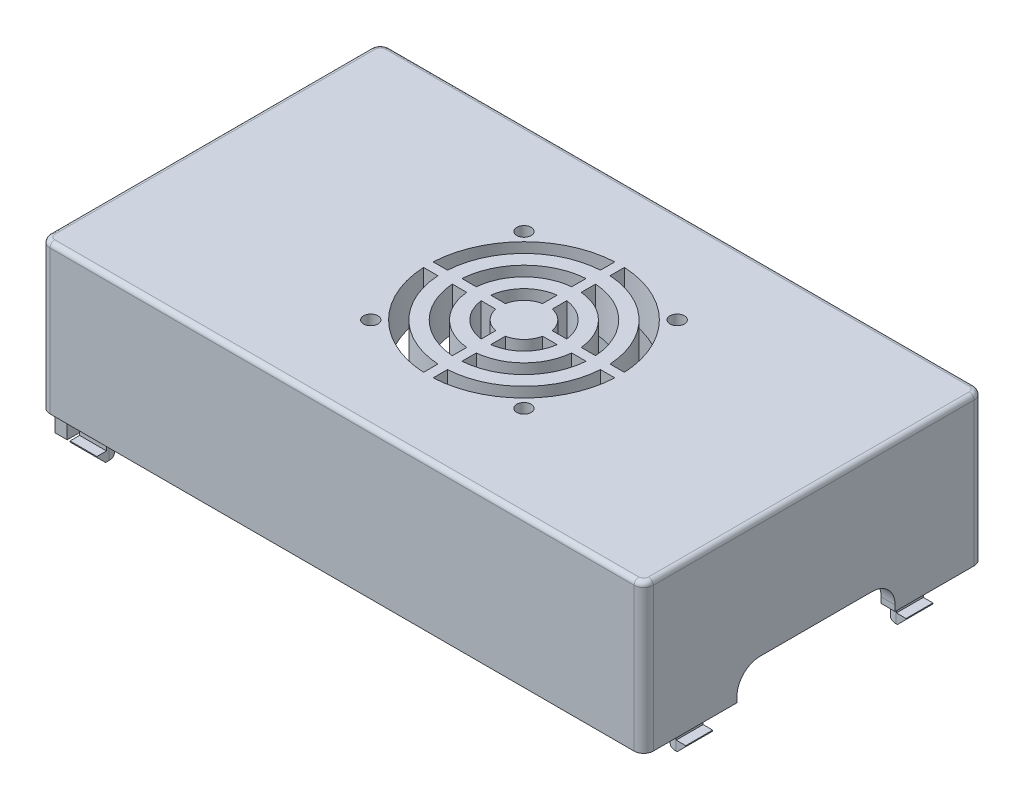
from build123d import *

# Parameters (mm, degrees)
SKETCH1_W           = 126
SKETCH1_H           = 71
BOSS_EXTRUDE1_DEPTH = 31
SKETCH2_W           = 120.6
SKETCH2_H           = 66
CUT_EXTRUDE1_DEPTH  = 22
CUT_EXTRUDE2_REACH  = 136.526
SKETCH3_W           = 33
SKETCH3_H           = 6
FILLET1_R           = 4.8
BOSS_EXTRUDE2_DEPTH = 2.5
CUT_EXTRUDE3_DEPTH  = 88.916153237
SKETCH6_R           = 1.5
CUT_EXTRUDE4_DEPTH  = 88.916153237
FILLET2_R           = 2
FILLET3_R           = 1
BOSS_EXTRUDE3_DEPTH = 4.7
BOSS_EXTRUDE4_START = 5.3
BOSS_EXTRUDE4_DEPTH = 5.3
CUT_EXTRUDE5_DEPTH  = 60.5
CUT_EXTRUDE6_REACH  = 100.093
BOSS_EXTRUDE5_DEPTH = 5.62751
BOSS_EXTRUDE6_DEPTH = 5.62751
BOSS_EXTRUDE7_DEPTH = 5.62751


with BuildPart() as part:
    # Sketch1 → Boss-Extrude1 (new body)
    with BuildSketch(Plane(origin=(0, 0, 0), x_dir=(1, 0, 0), z_dir=(0, 1, 0))):
        Rectangle(SKETCH1_W, SKETCH1_H)
    extrude(amount=BOSS_EXTRUDE1_DEPTH)

    # Sketch2 → Cut-Extrude1 (cut)
    with BuildSketch(Plane.XZ):
        with Locations((-0.2, 0)):
            Rectangle(SKETCH2_W, SKETCH2_H)
    extrude(amount=-CUT_EXTRUDE1_DEPTH, mode=Mode.SUBTRACT)

    # Sketch3 → Cut-Extrude2 (cut, up to next)
    with BuildSketch(Plane(origin=(63, 0, 0), x_dir=(0, 0, -1), z_dir=(1, 0, 0)), mode=Mode.PRIVATE) as cut_extrude2_sk1:
        with Locations((0.5, 3)):
            Rectangle(SKETCH3_W, SKETCH3_H)
    cut_extrude2_tool1 = extrude(cut_extrude2_sk1.sketch, amount=-CUT_EXTRUDE2_REACH, mode=Mode.PRIVATE) & part.part
    add(cut_extrude2_tool1.solids().sort_by_distance((63, 3, -0.5))[0], mode=Mode.SUBTRACT)

    # Fillet1
    fillet1_edges = [part.edges().sort_by_distance(p)[0] for p in [
        (61.55, 6, -17),
        (61.55, 6, 16),
    ]]
    fillet(fillet1_edges, radius=FILLET1_R)

    # Sketch4 → Boss-Extrude2 (add)
    with BuildSketch(Plane.ZY.offset(63)):
        Polygon((-32.6, 0), (-32.6, -19), (5, -19), (5, -6), (32.4, -6), (32.4, 0), align=None)
    extrude(amount=-BOSS_EXTRUDE2_DEPTH)

    # Sketch5 → Cut-Extrude3 (cut, through all)
    with BuildSketch(Plane(origin=(0, 31, 0), x_dir=(1, 0, 0), z_dir=(0, 1, 0))):
        with BuildLine():
            Line((3.5, 4.898979486), (3.5, 7.937253933))
            ThreePointArc((3.5, 7.937253933), (8.156854249, 5.656854249), (10.437253933, 1))
            Line((10.437253933, 1), (7.398979486, 1))
            ThreePointArc((7.398979486, 1), (6.035533906, 3.535533906), (3.5, 4.898979486))
        make_face()
        with BuildLine():
            Line((1.5, -4.898979486), (1.5, -7.937253933))
            ThreePointArc((1.5, -7.937253933), (-3.156854249, -5.656854249), (-5.437253933, -1))
            Line((-5.437253933, -1), (-2.398979486, -1))
            ThreePointArc((-2.398979486, -1), (-1.035533906, -3.535533906), (1.5, -4.898979486))
        make_face()
        with BuildLine():
            Line((7.398979486, -1), (10.437253933, -1))
            ThreePointArc((10.437253933, -1), (8.156854249, -5.656854249), (3.5, -7.937253933))
            Line((3.5, -7.937253933), (3.5, -4.898979486))
            ThreePointArc((3.5, -4.898979486), (6.035533906, -3.535533906), (7.398979486, -1))
        make_face()
        with BuildLine():
            Line((-2.398979486, 1), (-5.437253933, 1))
            ThreePointArc((-5.437253933, 1), (-3.156854249, 5.656854249), (1.5, 7.937253933))
            Line((1.5, 7.937253933), (1.5, 4.898979486))
            ThreePointArc((1.5, 4.898979486), (-1.035533906, 3.535533906), (-2.398979486, 1))
        make_face()
        with BuildLine():
            Line((1.5, 10.95445115), (1.5, 13.964240044))
            ThreePointArc((1.5, 13.964240044), (-7.399494937, 9.899494937), (-11.464240044, 1))
            Line((-11.464240044, 1), (-8.45445115, 1))
            ThreePointArc((-8.45445115, 1), (-5.278174593, 7.778174593), (1.5, 10.95445115))
        make_face()
        with BuildLine():
            Line((1.5, 16.970562748), (1.5, 19.974984355))
            ThreePointArc((1.5, 19.974984355), (-11.642135624, 14.142135624), (-17.474984355, 1))
            Line((-17.474984355, 1), (-14.470562748, 1))
            ThreePointArc((-14.470562748, 1), (-9.52081528, 12.02081528), (1.5, 16.970562748))
        make_face()
        with BuildLine():
            Line((3.5, 16.970562748), (3.5, 19.974984355))
            ThreePointArc((3.5, 19.974984355), (16.642135624, 14.142135624), (22.474984355, 1))
            Line((22.474984355, 1), (19.470562748, 1))
            ThreePointArc((19.470562748, 1), (14.52081528, 12.02081528), (3.5, 16.970562748))
        make_face()
        with BuildLine():
            Line((3.5, 10.95445115), (3.5, 13.964240044))
            ThreePointArc((3.5, 13.964240044), (12.399494937, 9.899494937), (16.464240044, 1))
            Line((16.464240044, 1), (13.45445115, 1))
            ThreePointArc((13.45445115, 1), (10.278174593, 7.778174593), (3.5, 10.95445115))
        make_face()
        with BuildLine():
            Line((-8.45445115, -1), (-11.464240044, -1))
            ThreePointArc((-11.464240044, -1), (-7.399494937, -9.899494937), (1.5, -13.964240044))
            Line((1.5, -13.964240044), (1.5, -10.95445115))
            ThreePointArc((1.5, -10.95445115), (-5.278174593, -7.778174593), (-8.45445115, -1))
        make_face()
        with BuildLine():
            Line((-14.470562748, -1), (-17.474984355, -1))
            ThreePointArc((-17.474984355, -1), (-11.642135624, -14.142135624), (1.5, -19.974984355))
            Line((1.5, -19.974984355), (1.5, -16.970562748))
            ThreePointArc((1.5, -16.970562748), (-9.52081528, -12.02081528), (-14.470562748, -1))
        make_face()
        with BuildLine():
            Line((3.5, -10.95445115), (3.5, -13.964240044))
            ThreePointArc((3.5, -13.964240044), (12.399494937, -9.899494937), (16.464240044, -1))
            Line((16.464240044, -1), (13.45445115, -1))
            ThreePointArc((13.45445115, -1), (10.278174593, -7.778174593), (3.5, -10.95445115))
        make_face()
        with BuildLine():
            Line((3.5, -16.970562748), (3.5, -19.974984355))
            ThreePointArc((3.5, -19.974984355), (16.642135624, -14.142135624), (22.474984355, -1))
            Line((22.474984355, -1), (19.470562748, -1))
            ThreePointArc((19.470562748, -1), (14.52081528, -12.02081528), (3.5, -16.970562748))
        make_face()
    extrude(amount=-CUT_EXTRUDE3_DEPTH, mode=Mode.SUBTRACT)

    # Sketch6 → Cut-Extrude4 (cut, through all)
    with BuildSketch(Plane(origin=(0, 31, 0), x_dir=(1, 0, 0), z_dir=(0, 1, 0))):
        with Locations(Location((-13.5, 16, 0), (0, 0, 270))):
            Circle(SKETCH6_R)
        with Locations(Location((18.5, 16, 0), (0, 0, 270))):
            Circle(SKETCH6_R)
        with Locations(Location((18.5, -16, 0), (0, 0, 270))):
            Circle(SKETCH6_R)
        with Locations(Location((-13.5, -16, 0), (0, 0, 270))):
            Circle(SKETCH6_R)
    extrude(amount=-CUT_EXTRUDE4_DEPTH, mode=Mode.SUBTRACT)

    # Fillet2
    fillet2_edges = [part.edges().sort_by_distance(p)[0] for p in [
        (-63, 15.5, 35.5),
        (-63, 15.5, -35.5),
        (63, 15.5, -35.5),
        (63, 15.5, 35.5),
    ]]
    fillet(fillet2_edges, radius=FILLET2_R)

    # Fillet3
    fillet3_edges = [part.edges().sort_by_distance(p)[0] for p in [
        (0, 31, 35.5),
        (-63, 31, 0),
        (63, 31, 0),
        (0, 31, -35.5),
        (62.414213562, 31, 34.914213562),
        (62.414213562, 31, -34.914213562),
        (-62.414213562, 31, -34.914213562),
        (-62.414213562, 31, 34.914213562),
    ]]
    fillet(fillet3_edges, radius=FILLET3_R)

    # Sketch7 → Boss-Extrude3 (add)
    with BuildSketch(Plane.XZ):
        with BuildLine():
            Line((-57.313755, 32.51305), (-57.313755, 33))
            Line((-57.313755, 33), (-51.686245, 33))
            Line((-51.686245, 33), (-51.686245, 32.51305))
            ThreePointArc((-51.686245, 32.51305), (-54.5, 29.699295), (-57.313755, 32.51305))
        make_face()
        with BuildLine():
            Line((-57.313755, -32.51305), (-57.313755, -33))
            Line((-57.313755, -33), (-51.686245, -33))
            Line((-51.686245, -33), (-51.686245, -32.51305))
            ThreePointArc((-51.686245, -32.51305), (-54.5, -29.699295), (-57.313755, -32.51305))
        make_face()
        with BuildLine():
            Line((60.01305, -25.813755), (60.1, -25.813755))
            Line((60.1, -25.813755), (60.1, -20.186245))
            Line((60.1, -20.186245), (60.01305, -20.186245))
            ThreePointArc((60.01305, -20.186245), (57.199295, -23), (60.01305, -25.813755))
        make_face()
        with BuildLine():
            Line((60.01305, 25.813755), (60.1, 25.813755))
            Line((60.1, 25.813755), (60.1, 20.186245))
            Line((60.1, 20.186245), (60.01305, 20.186245))
            ThreePointArc((60.01305, 20.186245), (57.199295, 23), (60.01305, 25.813755))
        make_face()
    extrude(amount=-BOSS_EXTRUDE3_DEPTH)

    # Sketch8 → Boss-Extrude4 (add)
    with BuildSketch(Plane.XZ.offset(BOSS_EXTRUDE4_START)):
        with BuildLine():
            Line((-57.313755, 33), (-57.313755, 32.51305))
            ThreePointArc((-57.313755, 32.51305), (-54.5, 29.699295), (-51.686245, 32.51305))
            Line((-51.686245, 32.51305), (-51.686245, 33))
            Line((-51.686245, 33), (-57.313755, 33))
        make_face()
        with BuildLine():
            Line((-57.313755, -32.51305), (-57.313755, -33))
            Line((-57.313755, -33), (-51.686245, -33))
            Line((-51.686245, -33), (-51.686245, -32.51305))
            ThreePointArc((-51.686245, -32.51305), (-54.5, -29.699295), (-57.313755, -32.51305))
        make_face()
        with BuildLine():
            Line((60.01305, -25.813755), (60.1, -25.813755))
            Line((60.1, -25.813755), (60.1, -20.186245))
            Line((60.1, -20.186245), (60.01305, -20.186245))
            ThreePointArc((60.01305, -20.186245), (57.199295, -23), (60.01305, -25.813755))
        make_face()
        with BuildLine():
            Line((60.01305, 20.186245), (60.1, 20.186245))
            Line((60.1, 20.186245), (60.1, 25.813755))
            Line((60.1, 25.813755), (60.01305, 25.813755))
            ThreePointArc((60.01305, 25.813755), (57.199295, 23), (60.01305, 20.186245))
        make_face()
    extrude(amount=-BOSS_EXTRUDE4_DEPTH)

    # Sketch9 → Cut-Extrude5 (cut)
    with BuildSketch(Plane(origin=(0, 0, 0), x_dir=(0, 0, -1), z_dir=(1, 0, 0))):
        Polygon((-33, 4.7), (-29.699295, 1.399295), (-29.699295, 4.7), align=None)
        Polygon((33, 4.7), (29.699295, 1.399295), (29.699295, 4.7), align=None)
    extrude(amount=-CUT_EXTRUDE5_DEPTH, mode=Mode.SUBTRACT)

    # Cut-Extrude6: up to this face of the body (flat: up to its plane)
    cut_extrude6_end = Plane(part.part.faces().sort_by_distance((0.346757949, 11.087098642, 33))[0])
    # Sketch10 → Cut-Extrude6 (cut, up to the picked face)
    with BuildSketch(Plane.XY.offset(-33), mode=Mode.PRIVATE) as cut_extrude6_sk1:
        Polygon((60.1, 4.7), (57.199295, 1.799295), (57.199295, 4.7), align=None)
    cut_extrude6_tool1 = split(extrude(cut_extrude6_sk1.sketch, amount=CUT_EXTRUDE6_REACH, mode=Mode.PRIVATE), bisect_by=cut_extrude6_end, keep=Keep.BOTH, mode=Mode.PRIVATE)
    add(cut_extrude6_tool1.solids().sort_by(Axis((58.166197, 3.733098, -33), (0, 0, 1)))[0], mode=Mode.SUBTRACT)

    # Sketch11 → Boss-Extrude5 (add)
    with BuildSketch(Plane.XY.offset(25.813755)):
        Polygon((60.1, -3.3), (62.1, -3.3), (62.1, -3.5), (60.3, -5.3), (60.1, -5.3), align=None)
    extrude(amount=-BOSS_EXTRUDE5_DEPTH)

    # Sketch12 → Boss-Extrude6 (add)
    with BuildSketch(Plane.XY.offset(-20.186245)):
        Polygon((60.1, -3.3), (62.1, -3.3), (62.1, -3.5), (60.3, -5.3), (60.1, -5.3), align=None)
    extrude(amount=-BOSS_EXTRUDE6_DEPTH)

    # Sketch13 → Boss-Extrude7 (add)
    with BuildSketch(Plane(origin=(-51.686245, 0, 0), x_dir=(0, 0, -1), z_dir=(1, 0, 0))):
        Polygon((-33, -3.3), (-35, -3.3), (-35, -3.5), (-33.2, -5.3), (-33, -5.3), align=None)
        Polygon((33, -5.3), (33.2, -5.3), (35, -3.5), (35, -3.3), (33, -3.3), align=None)
    extrude(amount=-BOSS_EXTRUDE7_DEPTH)


solid = part.part
